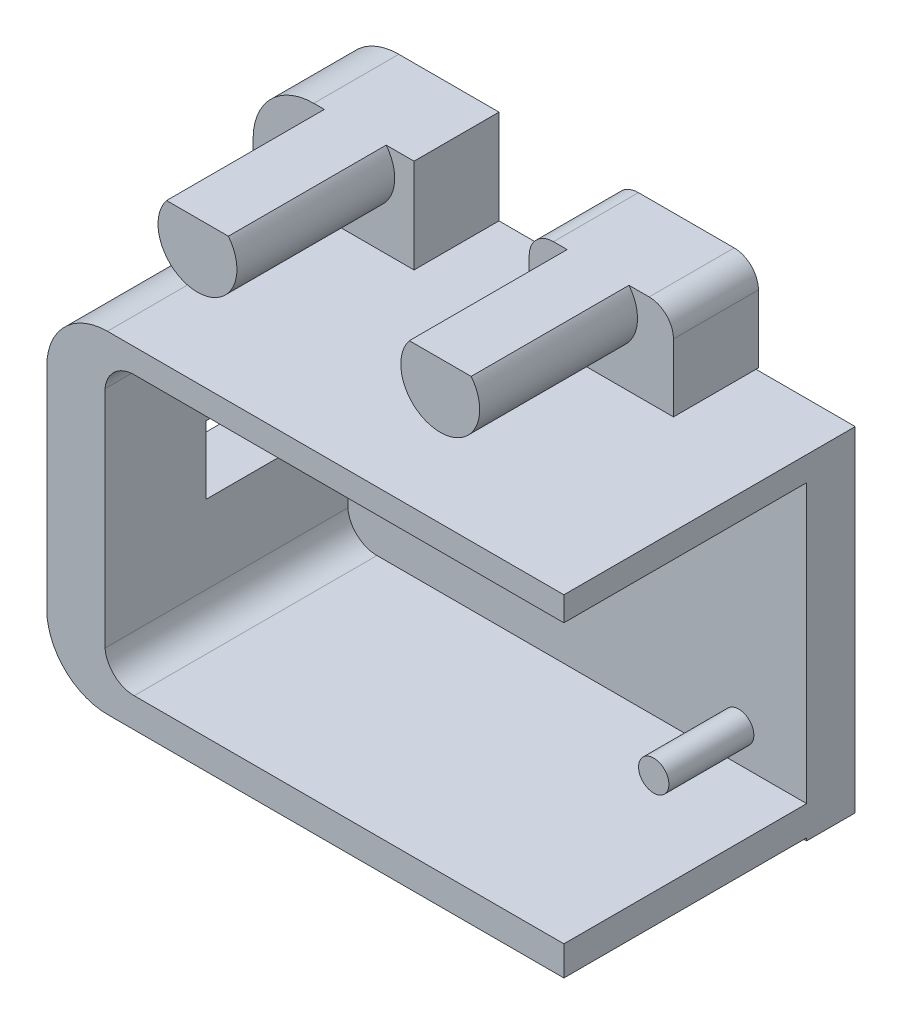
from build123d import *

# Parameters (mm, degrees)
BOSS_EXTRUDE1_DEPTH        = 2
BOSS_EXTRUDE1_DEPTH_BACK   = 11
BOSS_EXTRUDE1_2_DEPTH      = 2
BOSS_EXTRUDE1_2_DEPTH_BACK = 11
BOSS_EXTRUDE2_DEPTH        = 3
BOSS_EXTRUDE2_DEPTH_BACK   = 17
SKETCH3_W                  = 7.92818374
SKETCH3_H                  = 5.6
CUT_EXTRUDE1_DEPTH         = 5
SKETCH4_W                  = 42.6
SKETCH4_H                  = 27.559288912
SKETCH4_R                  = 1.25
BOSS_EXTRUDE3_DEPTH        = 4
SKETCH5_R                  = 1.25
BOSS_EXTRUDE4_DEPTH        = 11
SKETCH6_W                  = 11.884357557
SKETCH6_H                  = 7.561849503
SKETCH6_W_2                = 13.253647929
SKETCH6_H_2                = 7.761849503
BOSS_EXTRUDE5_DEPTH        = 7
FILLET1_R                  = 5
FILLET2_R                  = 5
FILLET3_R                  = 5
FILLET4_R                  = 2


with BuildPart() as part:
    # Sketch1 → Boss-Extrude1 (new, two sides: drawn at the far end of the back side and taken through both)
    with BuildSketch(Plane(origin=(0, 0, 43.786654763), x_dir=(-1, 0, 0), z_dir=(0, 0, -1)).offset(-BOSS_EXTRUDE1_DEPTH_BACK)):
        with BuildLine():
            ThreePointArc((34.985984859, 5), (34.805023511, 6.069346414), (34.282291473, 7.019609524))
            Line((34.282291473, 7.019609524), (29.189678246, 7.019609524))
            ThreePointArc((29.189678246, 7.019609524), (30.666638445, 1.930961348), (34.985984859, 5))
        make_face()
    extrude(amount=BOSS_EXTRUDE1_DEPTH + BOSS_EXTRUDE1_DEPTH_BACK)



with BuildPart() as body_2:
    # Sketch1 → Boss-Extrude1 2 (new, two sides: drawn at the far end of the back side and taken through both)
    with BuildSketch(Plane(origin=(0, 0, 43.786654763), x_dir=(-1, 0, 0), z_dir=(0, 0, -1)).offset(-BOSS_EXTRUDE1_2_DEPTH_BACK)):
        with BuildLine():
            Line((54.282291473, 7.019609524), (49.189678246, 7.019609524))
            ThreePointArc((49.189678246, 7.019609524), (50.666638445, 1.930961348), (54.985984859, 5))
            ThreePointArc((54.985984859, 5), (54.805023511, 6.069346414), (54.282291473, 7.019609524))
        make_face()
    extrude(amount=BOSS_EXTRUDE1_2_DEPTH + BOSS_EXTRUDE1_2_DEPTH_BACK)


with BuildPart() as body_3:
    # Sketch2 → Boss-Extrude2 (new, two sides: drawn at the far end of the back side and taken through both)
    with BuildSketch(Plane(origin=(0, 0, 41.786654763), x_dir=(-1, 0, 0), z_dir=(0, 0, -1)).offset(-BOSS_EXTRUDE2_DEPTH_BACK)):
        with BuildLine():
            Line((55.350131717, -4.942239979), (55.350131717, -23.442239979))
            ThreePointArc((55.350131717, -23.442239979), (54.580217463, -25.01142443), (52.950131717, -25.642239979))
            Line((52.950131717, -25.642239979), (17.550131717, -25.642239979))
            Line((17.550131717, -25.642239979), (17.550131717, -28.081825493))
            Line((17.550131717, -28.081825493), (60.150131717, -28.081825493))
            Line((60.150131717, -28.081825493), (60.150131717, -0.742239979))
            Line((60.150131717, -0.742239979), (17.550131717, -0.742239979))
            Line((17.550131717, -0.742239979), (17.550131717, -2.742239979))
            Line((17.550131717, -2.742239979), (52.950131717, -2.742239979))
            ThreePointArc((52.950131717, -2.742239979), (54.580217463, -3.373055529), (55.350131717, -4.942239979))
        make_face()
    extrude(amount=BOSS_EXTRUDE2_DEPTH + BOSS_EXTRUDE2_DEPTH_BACK)

    # Sketch3 → Cut-Extrude1 (cut)
    with BuildSketch(Plane.ZY.offset(60.150131717)):
        with Locations((46.497736517, -14.192239979)):
            Rectangle(SKETCH3_W, SKETCH3_H)
    extrude(amount=-CUT_EXTRUDE1_DEPTH, mode=Mode.SUBTRACT)

    # Sketch4 → Boss-Extrude3 (add)
    with BuildSketch(Plane(origin=(0, 0, 38.786654763), x_dir=(-1, 0, 0), z_dir=(0, 0, -1))):
        with Locations((38.850131717, -14.521884435)):
            Rectangle(SKETCH4_W, SKETCH4_H)
        with Locations((23.150131717, -5.442239979)):
            Circle(SKETCH4_R, mode=Mode.SUBTRACT)
        with Locations((23.150131717, -22.942239979)):
            Circle(SKETCH4_R, mode=Mode.SUBTRACT)
    extrude(amount=BOSS_EXTRUDE3_DEPTH)

    # Sketch5 → Boss-Extrude4 (add)
    with BuildSketch(Plane(origin=(0, 0, 34.786654763), x_dir=(-1, 0, 0), z_dir=(0, 0, -1))):
        with Locations((23.150131717, -5.442239979)):
            Circle(SKETCH5_R)
        with Locations((23.150131717, -22.942239979)):
            Circle(SKETCH5_R)
    extrude(amount=-BOSS_EXTRUDE4_DEPTH)


with BuildPart() as part_1:
    add(part.part)

    add(body_2.part)  # Boss-Extrude5 merges body 2

    add(body_3.part)  # Boss-Extrude5 merges body 3
    # Sketch6 → Boss-Extrude5 (add)
    with BuildSketch(Plane(origin=(0, 0, 41.786654763), x_dir=(-1, 0, 0), z_dir=(0, 0, -1))):
        with Locations((31.466833118, 3.238684773)):
            Rectangle(SKETCH6_W, SKETCH6_H)
        with Locations((53.523307753, 3.138684773)):
            Rectangle(SKETCH6_W_2, SKETCH6_H_2)
    extrude(amount=BOSS_EXTRUDE5_DEPTH)

    # Fillet1
    fillet1_edges = [part_1.edges().sort_by_distance(p)[0] for p in [
        (-60.150131717, -28.081825493, 48.786654763),
        (-60.150131717, -0.742239979, 50.286654763),
    ]]
    fillet(fillet1_edges, radius=FILLET1_R)

    # Fillet2
    fillet2_edges = [part_1.edges().sort_by_distance(p)[0] for p in [
        (-60.150131717, -28.301528891, 36.786654763),
    ]]
    fillet(fillet2_edges, radius=FILLET2_R)

    # Fillet3
    fillet3_edges = [part_1.edges().sort_by_distance(p)[0] for p in [
        (-60.150131717, 7.019609524, 38.286654763),
    ]]
    fillet(fillet3_edges, radius=FILLET3_R)

    # Fillet4
    fillet4_edges = [part_1.edges().sort_by_distance(p)[0] for p in [
        (-37.409011897, 7.019609524, 38.286654763),
        (-25.52465434, 7.019609524, 38.286654763),
    ]]
    fillet(fillet4_edges, radius=FILLET4_R)


solid = part_1.part
